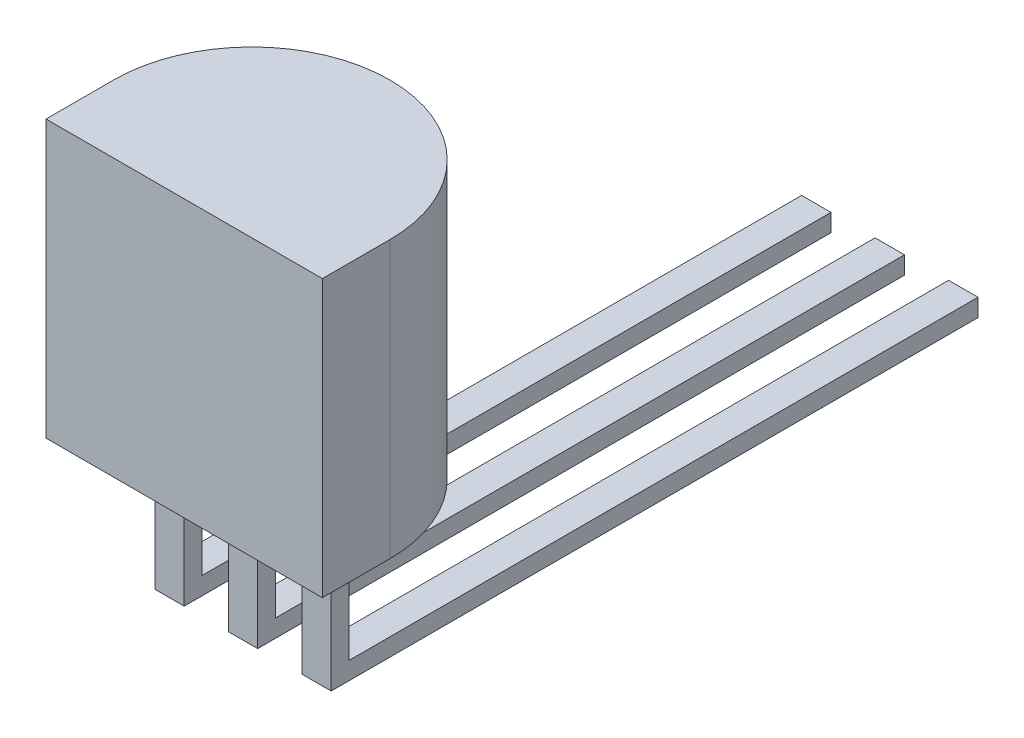
from build123d import *

# Parameters (mm, degrees)
EXTRUDE_1_DEPTH = 4.7
SKETCH_2_W      = 0.5
SKETCH_2_H      = 0.3
EXTRUDE_2_DEPTH = 2
SKETCH_3_W      = 0.5
SKETCH_3_H      = 0.3
EXTRUDE_3_DEPTH = 11


with BuildPart() as part:
    # 草图1 → 凸台-拉伸1 (new body)
    with BuildSketch(Plane(origin=(0, 0, 0), x_dir=(1, 0, 0), z_dir=(0, 1, 0))):
        with BuildLine():
            Line((-2.35, 0), (2.35, 0))
            Line((2.35, 0), (2.35, 1.15))
            ThreePointArc((2.35, 1.15), (0, 3.5), (-2.35, 1.15))
            Line((-2.35, 1.15), (-2.35, 0))
        make_face()
    extrude(amount=EXTRUDE_1_DEPTH)

    # 草图2 → 凸台-拉伸2 (add)
    with BuildSketch(Plane.XZ):
        with Locations((1.25, -1.15)):
            Rectangle(SKETCH_2_W, SKETCH_2_H)
        with Locations((0, -1.15)):
            Rectangle(SKETCH_2_W, SKETCH_2_H)
        with Locations((-1.25, -1.15)):
            Rectangle(SKETCH_2_W, SKETCH_2_H)
    extrude(amount=EXTRUDE_2_DEPTH)

    # 草图3 → 凸台-拉伸3 (add)
    with BuildSketch(Plane.XY.offset(-1)):
        with Locations((0, -2.15)):
            Rectangle(SKETCH_3_W, SKETCH_3_H)
        with Locations((-1.25, -2.15)):
            Rectangle(SKETCH_3_W, SKETCH_3_H)
        with Locations((1.25, -2.15)):
            Rectangle(SKETCH_3_W, SKETCH_3_H)
    extrude(amount=-EXTRUDE_3_DEPTH)


solid = part.part
